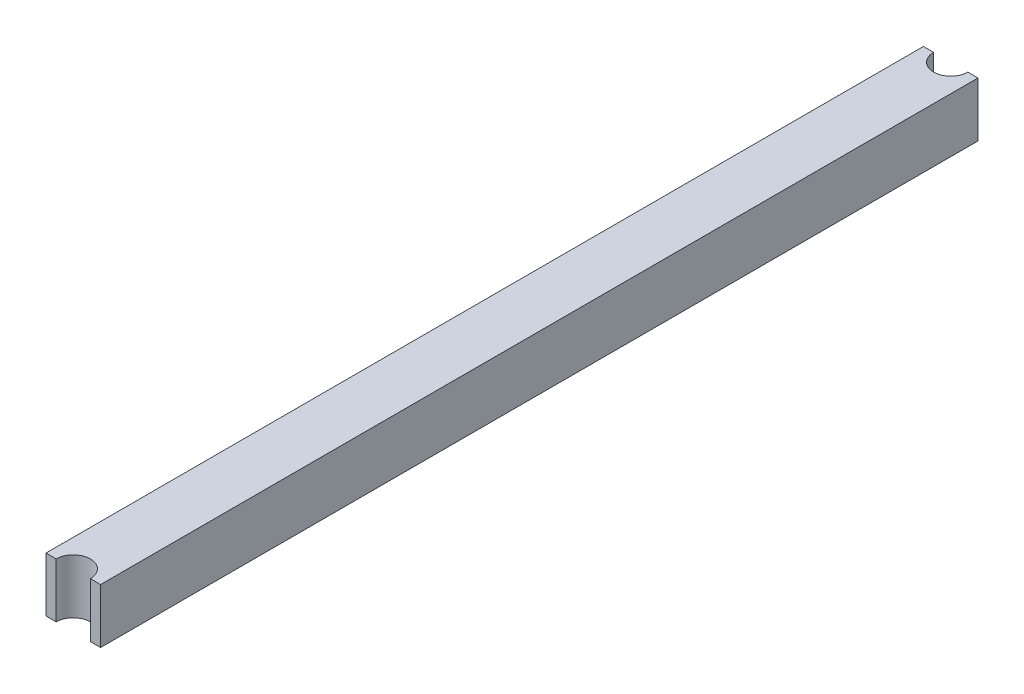
from build123d import *

# Parameters (mm, degrees)
SKETCH1_W           = 31.1
SKETCH1_H           = 31.1
BOSS_EXTRUDE1_DEPTH = 500
SKETCH2_R           = 9.755
CUT_EXTRUDE1_DEPTH  = 31.1
SKETCH3_R           = 9.755
CUT_EXTRUDE2_DEPTH  = 31.1


with BuildPart() as part:
    # Sketch1 → Boss-Extrude1 (new body)
    with BuildSketch(Plane.XY):
        with Locations((-15.55, 15.55)):
            Rectangle(SKETCH1_W, SKETCH1_H)
    extrude(amount=BOSS_EXTRUDE1_DEPTH)

    # Sketch2 → Cut-Extrude1 (cut)
    with BuildSketch(Plane(origin=(0, 31.1, 0), x_dir=(1, 0, 0), z_dir=(0, 1, 0))):
        with Locations((-15.55, 0)):
            Circle(SKETCH2_R)
    extrude(amount=-CUT_EXTRUDE1_DEPTH, mode=Mode.SUBTRACT)

    # Sketch3 → Cut-Extrude2 (cut)
    with BuildSketch(Plane(origin=(0, 31.1, 0), x_dir=(1, 0, 0), z_dir=(0, 1, 0))):
        with Locations((-15.55, -500)):
            Circle(SKETCH3_R)
    extrude(amount=-CUT_EXTRUDE2_DEPTH, mode=Mode.SUBTRACT)


solid = part.part
